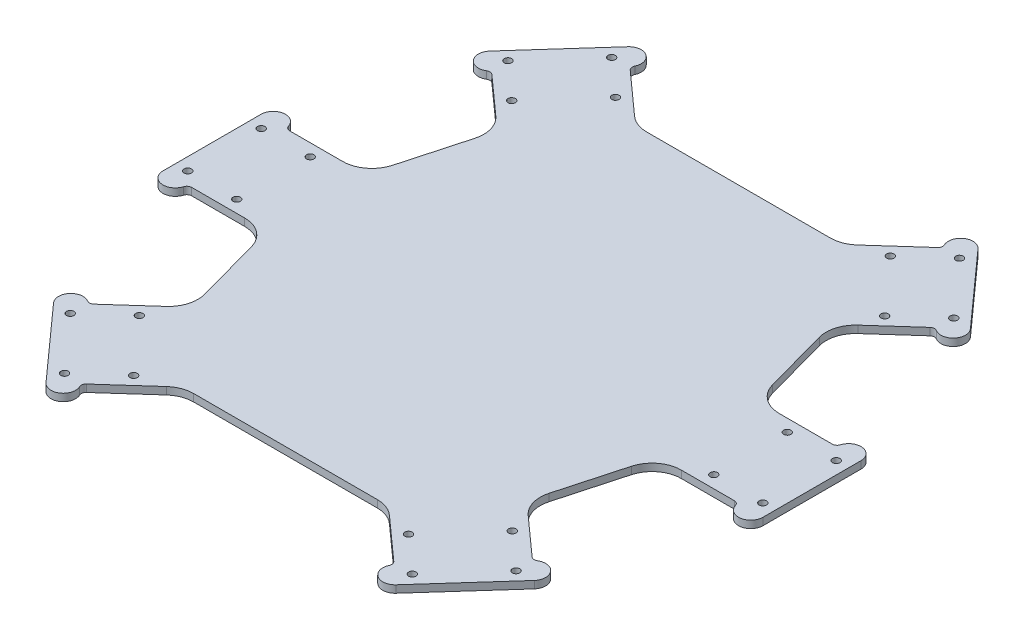
from build123d import *

# Parameters (mm, degrees)
SKETCH2_R               = 1.5
BOSS_EXTRUDE1_DEPTH     = 3
SKETCH7_R               = 1.5
CUT_EXTRUDE4_DEPTH      = 10
MIRROR2_COPY_1_SKETCH_R = 1.5
MIRROR2_COPY_1_DEPTH    = 10
CUT_EXTRUDE5_START      = -10
SKETCH8_R               = 1.5
CUT_EXTRUDE5_DEPTH      = 10


with BuildPart() as part:
    # Sketch2 → Boss-Extrude1 (new body)
    with BuildSketch(Plane(origin=(0, 0, 0), x_dir=(1, 0, 0), z_dir=(0, 1, 0))):
        with BuildLine():
            Line((77.604131862, 28.818122204), (70.352023373, 55.1894258))
            ThreePointArc((70.352023373, 55.1894258), (70.409142384, 61.75403485), (73.912058214, 67.306235788))
            Line((73.912058214, 67.306235788), (89.448492578, 81.235106792))
            ThreePointArc((89.448492578, 81.235106792), (90.603066053, 81.737789877), (91.829194878, 81.450843369))
            ThreePointArc((91.829194878, 81.450843369), (98.283456403, 82.511045735), (98.166159929, 89.050752337))
            Line((98.166159929, 89.050752337), (71.464727022, 118.833859641))
            ThreePointArc((71.464727022, 118.833859641), (64.976597411, 119.661926694), (63.220516764, 113.361315481))
            ThreePointArc((63.220516764, 113.361315481), (63.372367291, 112.111246838), (62.747059671, 111.018214097))
            Line((62.747059671, 111.018214097), (45.510429872, 95.565067809))
            ThreePointArc((45.510429872, 95.565067809), (41.788403765, 93.292431435), (37.5, 92.5))
            Line((37.5, 92.5), (-37.5, 92.5))
            ThreePointArc((-37.5, 92.5), (-41.788403765, 93.292431435), (-45.510429872, 95.565067809))
            Line((-45.510429872, 95.565067809), (-62.747059671, 111.018214097))
            ThreePointArc((-62.747059671, 111.018214097), (-63.372367291, 112.111246838), (-63.220516764, 113.361315481))
            ThreePointArc((-63.220516764, 113.361315481), (-64.976597411, 119.661926694), (-71.464727022, 118.833859641))
            Line((-71.464727022, 118.833859641), (-98.166159929, 89.050752337))
            ThreePointArc((-98.166159929, 89.050752337), (-98.283456403, 82.511045735), (-91.829194878, 81.450843369))
            ThreePointArc((-91.829194878, 81.450843369), (-90.603066053, 81.737789877), (-89.448492578, 81.235106792))
            Line((-89.448492578, 81.235106792), (-73.912058214, 67.306235788))
            ThreePointArc((-73.912058214, 67.306235788), (-70.409142384, 61.75403485), (-70.352023373, 55.1894258))
            Line((-70.352023373, 55.1894258), (-77.604131862, 28.818122204))
            ThreePointArc((-77.604131862, 28.818122204), (-81.900757615, 22.455825506), (-89.174596575, 20))
            Line((-89.174596575, 20), (-110.791796068, 20))
            ThreePointArc((-110.791796068, 20), (-111.987024677, 20.396432549), (-112.708425763, 21.428571429))
            ThreePointArc((-112.708425763, 21.428571429), (-118.221847911, 24.947619184), (-122.5, 20))
            Line((-122.5, 20), (-122.5, -20))
            ThreePointArc((-122.5, -20), (-118.221847911, -24.947619184), (-112.708425762, -21.428571429))
            ThreePointArc((-112.708425762, -21.428571429), (-111.987024677, -20.396432549), (-110.791796067, -20))
            Line((-110.791796067, -20), (-89.174596575, -20))
            ThreePointArc((-89.174596575, -20), (-81.900757615, -22.455825506), (-77.604131862, -28.818122204))
            Line((-77.604131862, -28.818122204), (-70.352023373, -55.1894258))
            ThreePointArc((-70.352023373, -55.1894258), (-70.409142384, -61.75403485), (-73.912058214, -67.306235788))
            Line((-73.912058214, -67.306235788), (-89.448492578, -81.235106792))
            ThreePointArc((-89.448492578, -81.235106792), (-90.603066053, -81.737789877), (-91.829194878, -81.450843369))
            ThreePointArc((-91.829194878, -81.450843369), (-98.283456403, -82.511045735), (-98.166159929, -89.050752337))
            Line((-98.166159929, -89.050752337), (-71.464727022, -118.833859641))
            ThreePointArc((-71.464727022, -118.833859641), (-64.976597411, -119.661926694), (-63.220516764, -113.361315481))
            ThreePointArc((-63.220516764, -113.361315481), (-63.372367291, -112.111246838), (-62.747059671, -111.018214097))
            Line((-62.747059671, -111.018214097), (-45.510429872, -95.565067809))
            ThreePointArc((-45.510429872, -95.565067809), (-41.788403765, -93.292431435), (-37.5, -92.5))
            Line((-37.5, -92.5), (37.5, -92.5))
            ThreePointArc((37.5, -92.5), (41.788403765, -93.292431435), (45.510429872, -95.565067809))
            Line((45.510429872, -95.565067809), (62.747059671, -111.018214097))
            ThreePointArc((62.747059671, -111.018214097), (63.372367291, -112.111246838), (63.220516764, -113.361315481))
            ThreePointArc((63.220516764, -113.361315481), (64.976597411, -119.661926694), (71.464727022, -118.833859641))
            Line((71.464727022, -118.833859641), (98.166159929, -89.050752337))
            ThreePointArc((98.166159929, -89.050752337), (98.283456403, -82.511045735), (91.829194878, -81.450843369))
            ThreePointArc((91.829194878, -81.450843369), (90.603066053, -81.737789877), (89.448492578, -81.235106792))
            Line((89.448492578, -81.235106792), (73.912058214, -67.306235788))
            ThreePointArc((73.912058214, -67.306235788), (70.409142384, -61.75403485), (70.352023373, -55.1894258))
            Line((70.352023373, -55.1894258), (77.604131862, -28.818122204))
            ThreePointArc((77.604131862, -28.818122204), (81.900757615, -22.455825506), (89.174596575, -20))
            Line((89.174596575, -20), (110.791796067, -20))
            ThreePointArc((110.791796067, -20), (111.987024677, -20.396432549), (112.708425762, -21.428571429))
            ThreePointArc((112.708425762, -21.428571429), (118.221847911, -24.947619184), (122.5, -20))
            Line((122.5, -20), (122.5, 20))
            ThreePointArc((122.5, 20), (118.221847911, 24.947619184), (112.708425763, 21.428571429))
            ThreePointArc((112.708425763, 21.428571429), (111.987024677, 20.396432549), (110.791796068, 20))
            Line((110.791796068, 20), (89.174596575, 20))
            ThreePointArc((89.174596575, 20), (81.900757615, 22.455825506), (77.604131862, 28.818122204))
        make_face()
        with Locations(Location((-91.038580411, 89.375883412, 0), (0, 0, 270))):
            Circle(SKETCH2_R, mode=Mode.SUBTRACT)
        with Locations(Location((-71.012505731, 111.713213891, 0), (0, 0, 90))):
            Circle(SKETCH2_R, mode=Mode.SUBTRACT)
        with Locations(Location((91.038580411, 89.375883412, 0), (0, 0, 90))):
            Circle(SKETCH2_R, mode=Mode.SUBTRACT)
        with Locations(Location((71.012505731, 111.713213891, 0), (0, 0, 270))):
            Circle(SKETCH2_R, mode=Mode.SUBTRACT)
        with Locations(Location((91.038580411, -89.375883412, 0), (0, 0, 270))):
            Circle(SKETCH2_R, mode=Mode.SUBTRACT)
        with Locations(Location((71.012505731, -111.713213891, 0), (0, 0, 90))):
            Circle(SKETCH2_R, mode=Mode.SUBTRACT)
        with Locations(Location((-71.012505731, -111.713213891, 0), (0, 0, 270))):
            Circle(SKETCH2_R, mode=Mode.SUBTRACT)
        with Locations(Location((-91.038580411, -89.375883412, 0), (0, 0, 90))):
            Circle(SKETCH2_R, mode=Mode.SUBTRACT)
        with Locations(Location((-117.41, -15, 0), (0, 0, 270))):
            Circle(SKETCH2_R, mode=Mode.SUBTRACT)
        with Locations(Location((-117.41, 15, 0), (0, 0, 90))):
            Circle(SKETCH2_R, mode=Mode.SUBTRACT)
        with Locations(Location((117.41, -15, 0), (0, 0, 90))):
            Circle(SKETCH2_R, mode=Mode.SUBTRACT)
        with Locations(Location((117.41, 15, 0), (0, 0, 270))):
            Circle(SKETCH2_R, mode=Mode.SUBTRACT)
    extrude(amount=BOSS_EXTRUDE1_DEPTH)

    # Sketch7 → Cut-Extrude4 (cut)
    with BuildSketch(Plane(origin=(0, 3, 0), x_dir=(1, 0, 0), z_dir=(0, 1, 0))):
        with Locations(Location((-76.147026759, 76.025166959, 0), (0, 0, 270))):
            Circle(SKETCH7_R)
        with Locations(Location((-56.120952079, 98.362497437, 0), (0, 0, 270))):
            Circle(SKETCH7_R)
    cut_extrude4 = extrude(amount=-CUT_EXTRUDE4_DEPTH, mode=Mode.SUBTRACT)

    # Mirror1: Cut-Extrude4 across plane
    add(cut_extrude4.mirror(Plane(origin=(0, 0, 0), x_dir=(0, 0, 1), z_dir=(1, 0, 0))), mode=Mode.SUBTRACT)

    # Mirror2: Cut-Extrude4 across plane
    add(cut_extrude4.mirror(Plane.XY), mode=Mode.SUBTRACT)

    # Mirror2 copy 1 sketch → Mirror2 copy 1 (cut)
    with BuildSketch(Plane(origin=(0, 3, 0), x_dir=(-1, 0, 0), z_dir=(0, 1, 0))):
        with Locations(Location((-76.147026759, 76.025166959, 0), (0, 0, 270))):
            Circle(MIRROR2_COPY_1_SKETCH_R)
        with Locations(Location((-56.120952079, 98.362497437, 0), (0, 0, 270))):
            Circle(MIRROR2_COPY_1_SKETCH_R)
    extrude(amount=-MIRROR2_COPY_1_DEPTH, mode=Mode.SUBTRACT)

    # Sketch8 → Cut-Extrude5 (cut)
    with BuildSketch(Plane(origin=(0, 3, 0), x_dir=(1, 0, 0), z_dir=(0, 1, 0)).offset(CUT_EXTRUDE5_START)):
        with Locations(Location((-117.41, 15, 0), (0, 0, 90))):
            Circle(SKETCH8_R)
        with Locations(Location((-117.41, -15, 0), (0, 0, 270))):
            Circle(SKETCH8_R)
        with Locations(Location((-97.41, -15, 0), (0, 0, 270))):
            Circle(SKETCH8_R)
        with Locations(Location((-97.41, 15, 0), (0, 0, 270))):
            Circle(SKETCH8_R)
    cut_extrude5 = extrude(amount=CUT_EXTRUDE5_DEPTH, mode=Mode.SUBTRACT)

    # Mirror3: Cut-Extrude5 across plane
    add(cut_extrude5.mirror(Plane(origin=(0, 0, 0), x_dir=(0, 0, 1), z_dir=(1, 0, 0))), mode=Mode.SUBTRACT)


solid = part.part
